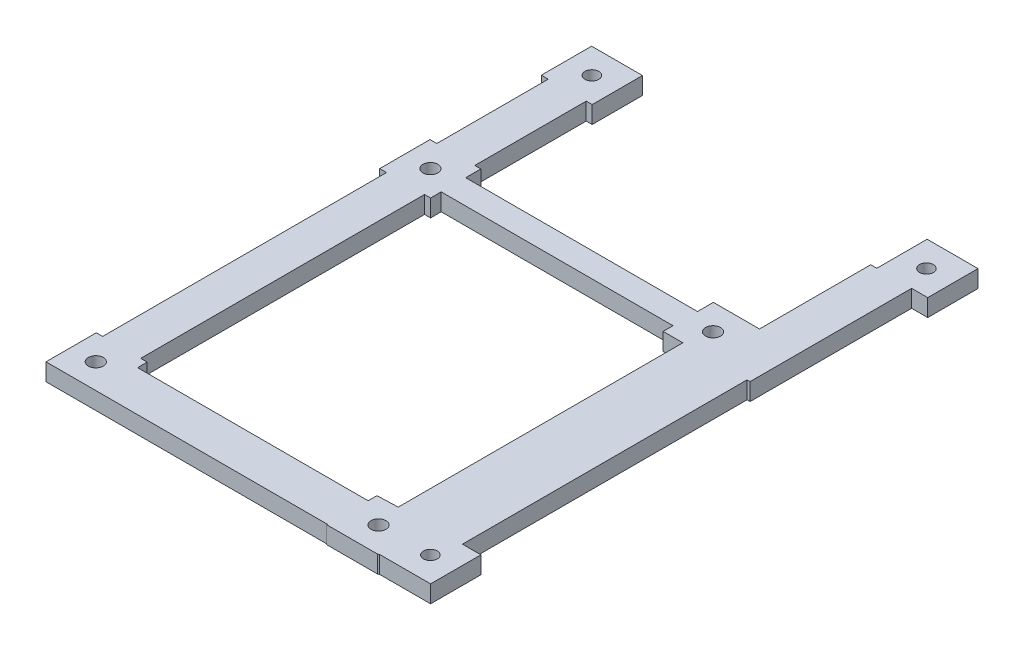
from build123d import *

# Parameters (mm, degrees)
SKETCH1_R           = 1.3
SKETCH1_R_2         = 1.2
BOSS_EXTRUDE1_DEPTH = 3


with BuildPart() as part:
    # Sketch1 → Boss-Extrude1 (new body)
    with BuildSketch(Plane(origin=(0, 0, 0), x_dir=(1, 0, 0), z_dir=(0, 1, 0))):
        Polygon((9.762662215, 65.669537047), (10.942509785, 65.669537047), (10.942509785, 84.984003028), (9.746724448, 84.984003028), (9.746724448, 93.703488322), (18.563219001, 93.703488322), (18.563219001, 84.984003028), (17.531387454, 84.984003028), (17.531387454, 65.669537047), (18.579156769, 65.669537047), (18.579156769, 63.040010061), (58.765583648, 63.040010061), (58.765583648, 65.796335383), (66.755517737, 65.796335383), (66.755517737, 85.084147443), (67.813967442, 85.084147443), (67.813967442, 93.803632737), (76.630461995, 93.803632737), (76.630461995, 85.084147443), (73.843318023, 85.084147443), (73.843318023, 57.076850089), (73.317218387, 57.076850089), (73.317218387, 7.739461046), (76.516310065, 7.739461046), (76.516310065, -0.980024248), (67.699815511, -0.980024248), (67.442656599, -1.105588805), (58.626162046, -1.105588805), (58.626162046, -0.977439081), (18.658261308, -0.977439081), (9.841766755, -0.977439081), (9.841766755, 7.742046212), (10.942509785, 7.742046212), (10.942509785, 56.950051753), (9.762662215, 56.950051753), align=None)
        with Locations(Location((14.154971724, 3.343745675, 0), (0, 0, 270))):
            Circle(SKETCH1_R, mode=Mode.SUBTRACT)
        with Locations(Location((63.154971724, 3.343745675, 0), (0, 0, 270))):
            Circle(SKETCH1_R, mode=Mode.SUBTRACT)
        with Locations(Location((14.154971724, 61.342146029, 0), (0, 0, 270))):
            Circle(SKETCH1_R, mode=Mode.SUBTRACT)
        with Locations(Location((63.154971698, 61.343745675, 0), (0, 0, 270))):
            Circle(SKETCH1_R, mode=Mode.SUBTRACT)
        with Locations(Location((72.154971724, 3.343745675, 0), (0, 0, 270))):
            Circle(SKETCH1_R_2, mode=Mode.SUBTRACT)
        with Locations(Location((72.154971724, 89.343745675, 0), (0, 0, 270))):
            Circle(SKETCH1_R_2, mode=Mode.SUBTRACT)
        with Locations(Location((14.154971724, 89.343745675, 0), (0, 0, 270))):
            Circle(SKETCH1_R_2, mode=Mode.SUBTRACT)
        Polygon((18.658261308, 7.742046212), (18.658261308, 6.082823098), (58.626162046, 6.082823098), (58.626162046, 7.613896488), (62.189336101, 7.739461046), (62.189336101, 57.076850089), (58.765583648, 57.076850089), (58.765583648, 58.793844452), (18.579156769, 58.793844452), (18.579156769, 56.950051753), (17.531387454, 56.950051753), (17.531387454, 7.742046212), align=None, mode=Mode.SUBTRACT)
    extrude(amount=BOSS_EXTRUDE1_DEPTH)


solid = part.part
